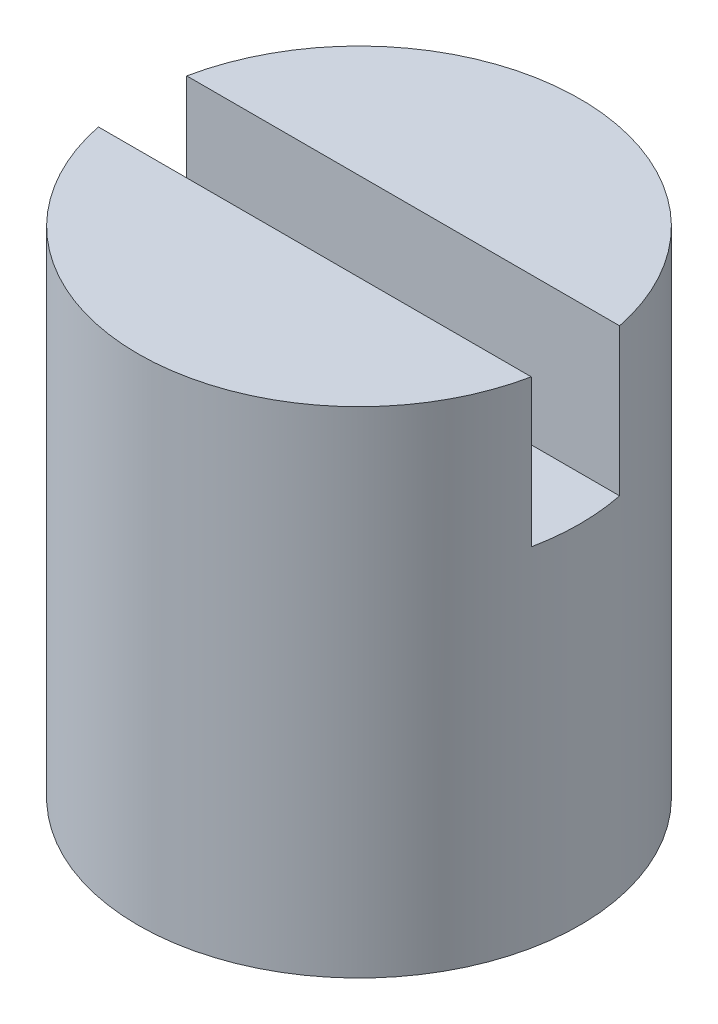
from build123d import *

# Parameters (mm, degrees)
SKETCH1_R           = 4.7625
BOSS_EXTRUDE1_DEPTH = 10.668
SKETCH2_W           = 9.525
SKETCH2_H           = 1.905
CUT_EXTRUDE1_DEPTH  = 3.175
SKETCH3_R           = 1.999996
CUT_EXTRUDE2_DEPTH  = 5


with BuildPart() as part:
    # Sketch1 → Boss-Extrude1 (new body)
    with BuildSketch(Plane(origin=(0, 0, 0), x_dir=(1, 0, 0), z_dir=(0, 1, 0))):
        with Locations(Location((0, 0, 0), (0, 0, 270))):
            Circle(SKETCH1_R)
    extrude(amount=-BOSS_EXTRUDE1_DEPTH)

    # Sketch2 → Cut-Extrude1 (cut)
    with BuildSketch(Plane(origin=(0, 0, 0), x_dir=(1, 0, 0), z_dir=(0, 1, 0))):
        Rectangle(SKETCH2_W, SKETCH2_H)
    extrude(amount=-CUT_EXTRUDE1_DEPTH, mode=Mode.SUBTRACT)

    # Sketch3 → Cut-Extrude2 (cut)
    with BuildSketch(Plane.XZ.offset(10.668)):
        with Locations(Location((0, 0, 0), (0, 0, 270))):
            Circle(SKETCH3_R)
    extrude(amount=-CUT_EXTRUDE2_DEPTH, mode=Mode.SUBTRACT)


solid = part.part
